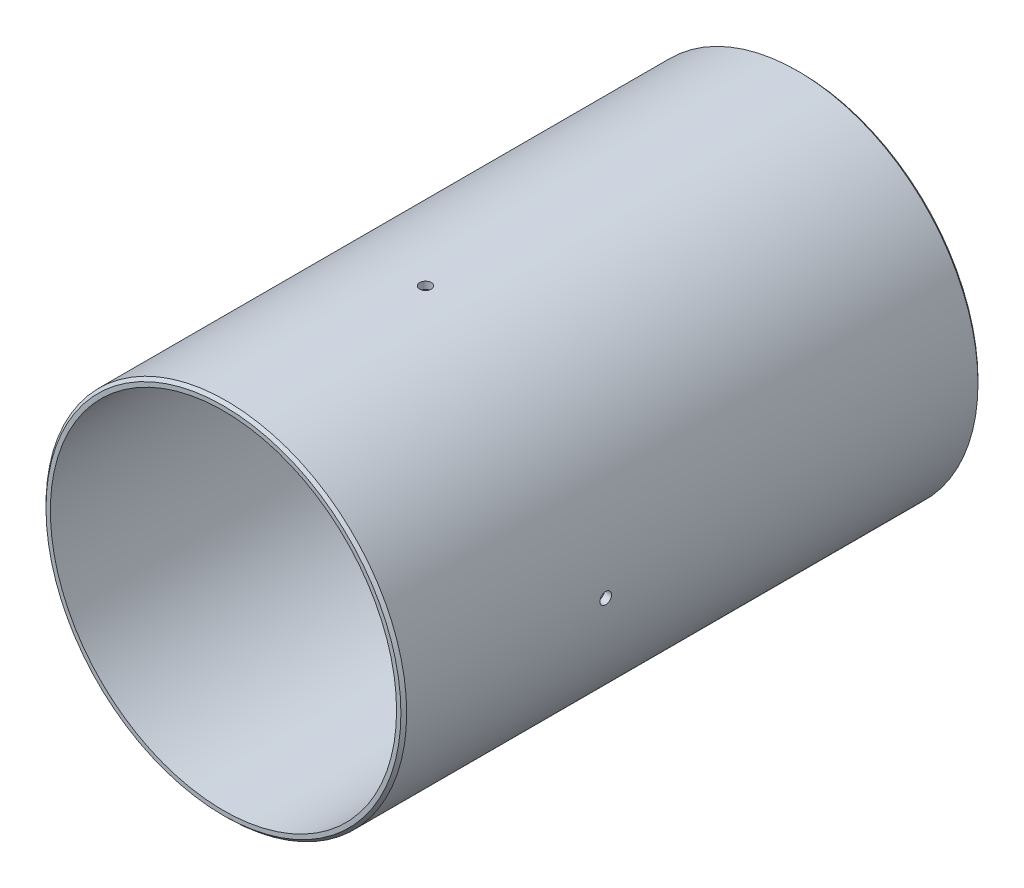
from build123d import *

# Parameters (mm, degrees)
SKETCH1_R           = 62.5
SKETCH1_R_2         = 60
BOSS_EXTRUDE1_DEPTH = 100
SKETCH2_R           = 2
CUT_EXTRUDE1_DEPTH  = 100
SKETCH3_R           = 2
CUT_EXTRUDE2_DEPTH  = 74
CHAMFER1_SIZE       = 1
CHAMFER2_SIZE       = 1


with BuildPart() as part:
    # Sketch1 → Boss-Extrude1 (new, symmetric)
    with BuildSketch(Plane.XY):
        Circle(SKETCH1_R)
        Circle(SKETCH1_R_2, mode=Mode.SUBTRACT)
    extrude(amount=BOSS_EXTRUDE1_DEPTH, both=True)

    # Sketch2 → Cut-Extrude1 (cut, symmetric)
    with BuildSketch(Plane(origin=(0, 0, 0), x_dir=(1, 0, 0), z_dir=(0, 1, 0))):
        with Locations(Location((0, -30, 0), (0, 0, 270))):
            Circle(SKETCH2_R)
    extrude(amount=CUT_EXTRUDE1_DEPTH, both=True, mode=Mode.SUBTRACT)

    # Sketch3 → Cut-Extrude2 (cut, symmetric)
    with BuildSketch(Plane(origin=(0, 0, 0), x_dir=(0, 0, -1), z_dir=(1, 0, 0))):
        with Locations((-30, 0)):
            Circle(SKETCH3_R)
    extrude(amount=CUT_EXTRUDE2_DEPTH, both=True, mode=Mode.SUBTRACT)

    # Chamfer1
    chamfer1_edges = [part.edges().sort_by_distance(p)[0] for p in [
        (-62.5, 0, 100),
    ]]
    chamfer(chamfer1_edges, length=CHAMFER1_SIZE)

    # Chamfer2
    chamfer2_edges = [part.edges().sort_by_distance(p)[0] for p in [
        (-62.5, 0, -100),
    ]]
    chamfer(chamfer2_edges, length=CHAMFER2_SIZE)


solid = part.part
